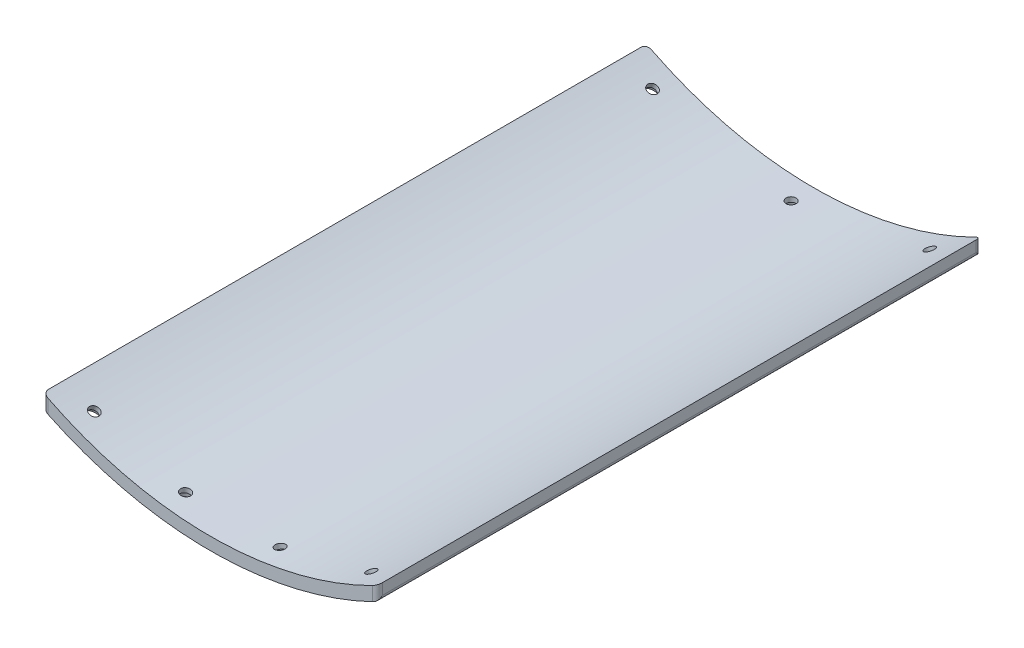
from build123d import *

# Parameters (mm, degrees)
BOSS_EXTRUDE1_DEPTH         = 120
BOSS_EXTRUDE1_DEPTH_BACK    = 120
FILLET1_R                   = 2
HOLE1_D                     = 4
HOLE1_CBORE_D               = 8
HOLE1_CBORE_DEPTH           = 3.1
HOLE1_ON_FACE_2_D           = 4
HOLE1_ON_FACE_2_CBORE_D     = 8
HOLE1_ON_FACE_2_CBORE_DEPTH = 3.1
HOLE1_ON_FACE_3_D           = 4
HOLE1_ON_FACE_3_CBORE_D     = 8
HOLE1_ON_FACE_3_CBORE_DEPTH = 3.1
HOLE1_ON_FACE_4_D           = 4
HOLE1_ON_FACE_4_CBORE_D     = 8
HOLE1_ON_FACE_4_CBORE_DEPTH = 3.1
HOLE1_ON_FACE_5_D           = 4
HOLE1_ON_FACE_5_CBORE_D     = 8
HOLE1_ON_FACE_5_CBORE_DEPTH = 3.1
HOLE1_ON_FACE_6_D           = 4
HOLE1_ON_FACE_6_CBORE_D     = 8
HOLE1_ON_FACE_6_CBORE_DEPTH = 3.1


with BuildPart() as part:
    # Sketch1 → Boss-Extrude1 (new, two sides: drawn at the far end of the back side and taken through both)
    with BuildSketch(Plane.XY.offset(-BOSS_EXTRUDE1_DEPTH_BACK)):
        with BuildLine():
            Line((-66.491800306, -127.729559978), (-66.491800306, -133.341068288))
            ThreePointArc((-66.491800306, -133.341068288), (0, -149), (66.491800306, -133.341068288))
            Line((66.491800306, -133.341068288), (66.491800306, -127.729559978))
            ThreePointArc((66.491800306, -127.729559978), (0, -144), (-66.491800306, -127.729559978))
        make_face()
    extrude(amount=BOSS_EXTRUDE1_DEPTH + BOSS_EXTRUDE1_DEPTH_BACK)

    # Fillet1
    fillet1_edges = [part.edges().sort_by_distance(p)[0] for p in [
        (-66.491800306, -130.535314133, 120),
        (66.491800306, -130.535314133, -120),
        (66.491800306, -130.535314133, 120),
        (-66.491800306, -130.535314133, -120),
        (66.491800306, -133.341068288, 0),
        (-66.491800306, -133.341068288, 0),
    ]]
    fillet(fillet1_edges, radius=FILLET1_R)

    # Hole1 (through all)
    with Locations(Plane(origin=(-57.019831422, -137.658050344, 111), x_dir=(-0.923879532511, 0.382683432365, 0), z_dir=(-0.382683432365, -0.923879532511, 0))):
        with Locations((0, 0)):
            CounterBoreHole(HOLE1_D / 2, HOLE1_CBORE_D / 2, HOLE1_CBORE_DEPTH)

    # Hole1 on face 2 (through all)
    with Locations(Plane(origin=(-19.448402641, -147.725284345, 111), x_dir=(-0.991444888611, 0.130525985335, 0), z_dir=(-0.130525985335, -0.991444888611, 0))):
        with Locations((0, 0)):
            CounterBoreHole(HOLE1_ON_FACE_2_D / 2, HOLE1_ON_FACE_2_CBORE_D / 2, HOLE1_ON_FACE_2_CBORE_DEPTH)

    # Hole1 on face 3 (through all)
    with Locations(Plane(origin=(19.448402641, -147.725284345, 111), x_dir=(-0.991444888611, -0.130525985335, 0), z_dir=(0.130525985335, -0.991444888611, 0))):
        with Locations((0, 0)):
            CounterBoreHole(HOLE1_ON_FACE_3_D / 2, HOLE1_ON_FACE_3_CBORE_D / 2, HOLE1_ON_FACE_3_CBORE_DEPTH)

    # Hole1 on face 4 (through all)
    with Locations(Plane(origin=(-57.019831422, -137.658050344, -111), x_dir=(-0.923879753837, 0.382682898036, 0), z_dir=(-0.382682898036, -0.923879753837, 0))):
        with Locations((0, 0)):
            CounterBoreHole(HOLE1_ON_FACE_4_D / 2, HOLE1_ON_FACE_4_CBORE_D / 2, HOLE1_ON_FACE_4_CBORE_DEPTH)

    # Hole1 on face 5 (through all)
    with Locations(Plane(origin=(0, -149, -111), x_dir=(0, 0, -1), z_dir=(0, -1, 0))):
        with Locations((0, 0)):
            CounterBoreHole(HOLE1_ON_FACE_5_D / 2, HOLE1_ON_FACE_5_CBORE_D / 2, HOLE1_ON_FACE_5_CBORE_DEPTH)

    # Hole1 on face 6 (through all)
    with Locations(Plane(origin=(57.019831422, -137.658050344, -111), x_dir=(-0.923879753837, -0.382682898036, 0), z_dir=(0.382682898036, -0.923879753837, 0))):
        with Locations((0, 0), (0, -222)):
            CounterBoreHole(HOLE1_ON_FACE_6_D / 2, HOLE1_ON_FACE_6_CBORE_D / 2, HOLE1_ON_FACE_6_CBORE_DEPTH)


solid = part.part
